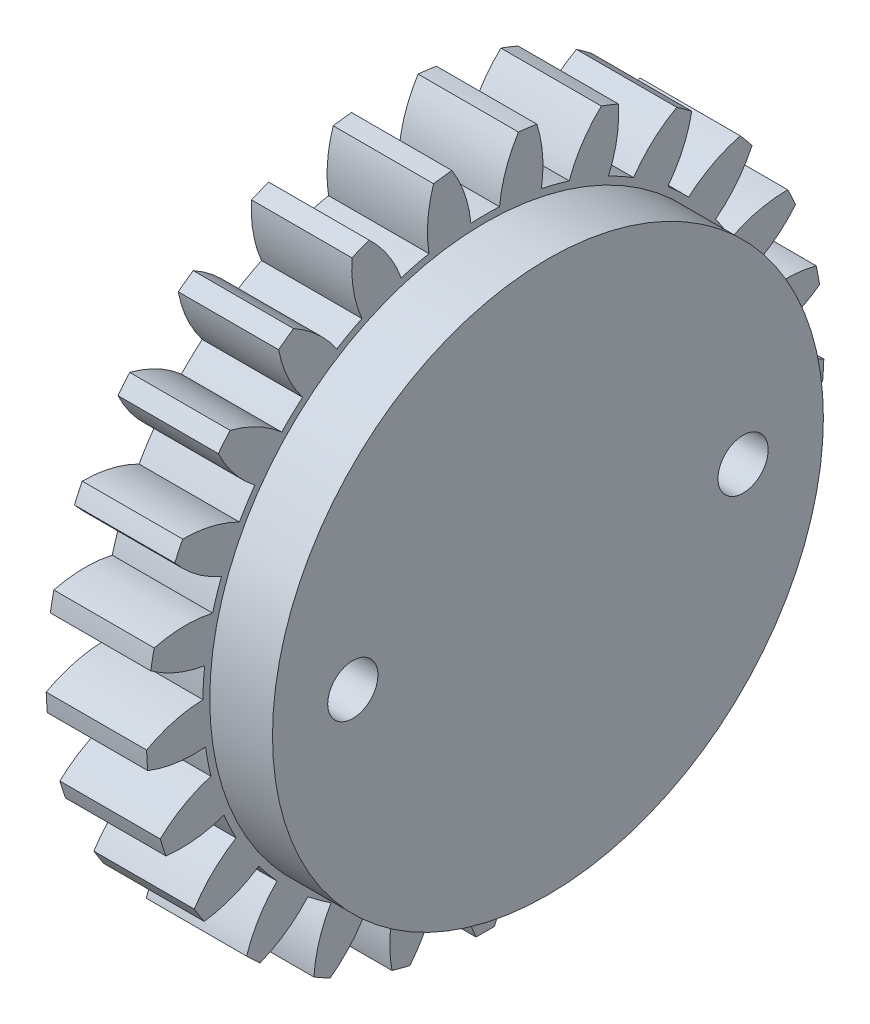
from build123d import *

# Parameters (mm, degrees)
BASPROSKE_W                  = 4
BASPROSKE_H                  = 13.5
TOOTHCUT_DEPTH               = 20.506409203
TEETHCUTS_COUNT              = 25
TEETHCUTS_ANGLE              = 345.6
BORSKE_R                     = 1.5
BORE_DEPTH                   = 50.0000508
ESQUISSE1_R                  = 4.015099064
BOSS_EXTRU_1_DEPTH           = 4
ESQUISSE3_R                  = 10.975
BOSS_EXTRU_2_DEPTH           = 2.5
ENL_V_MAT_EXTRU_1_DEPTH      = 20.500499542
ENL_V_MAT_EXTRU_1_DEPTH_BACK = 20.500499542
ESQUISSE2_R                  = 1
ESQUISSE4_R                  = 2
ENL_V_MAT_EXTRU_2_DEPTH      = 2.5


with BuildPart() as part:
    # BasProSke → Base-Revolve (revolve)
    with BuildSketch(Plane(origin=(0, 0, 0), x_dir=(1, 0, 0), z_dir=(0, 1, 0)), mode=Mode.PRIVATE) as base_revolve_sk:
        with Locations((2, 6.75)):
            Rectangle(BASPROSKE_W, BASPROSKE_H)
    revolve(base_revolve_sk.sketch.rotate(Axis((-10, 0, 0), (1, 0, 0)), 180), axis=Axis((-10, 0, 0), (1, 0, 0)))

    # TooCutSke → ToothCut (cut, through all)
    with BuildSketch(Plane(origin=(0, 0, 0), x_dir=(0, 0, -1), z_dir=(1, 0, 0))):
        with BuildLine():
            ThreePointArc((0.570809389, 11.23450834), (0, 11.249), (-0.570809389, 11.23450834))
            ThreePointArc((-0.570809389, 11.23450834), (-0.823468719, 12.39261054), (-1.341642157, 13.4586939))
            ThreePointArc((-1.341642157, 13.4586939), (0, 13.5254), (1.341642157, 13.4586939))
            ThreePointArc((1.341642157, 13.4586939), (0.823468719, 12.39261054), (0.570809389, 11.23450834))
        make_face()
    toothcut = extrude(amount=TOOTHCUT_DEPTH, mode=Mode.SUBTRACT)

    # TeethCuts: ToothCut ×25 about axis
    teethcuts_axis = Axis((-10, 0, 0), (1, 0, 0))
    for i in range(1, TEETHCUTS_COUNT):
        add(toothcut.rotate(teethcuts_axis, i * TEETHCUTS_ANGLE / (TEETHCUTS_COUNT - 1)), mode=Mode.SUBTRACT)

    # BorSke → Bore (cut, symmetric)
    with BuildSketch(Plane(origin=(0, 0, 0), x_dir=(0, 0, -1), z_dir=(1, 0, 0))):
        with Locations(Location((0, 0, 0), (0, 0, 180))):
            Circle(BORSKE_R)
    extrude(amount=BORE_DEPTH, both=True, mode=Mode.SUBTRACT)

    # Esquisse1 → Boss.-Extru.1 (add)
    with BuildSketch(Plane(origin=(4, 0, 0), x_dir=(0, 0, -1), z_dir=(1, 0, 0))):
        Circle(ESQUISSE1_R)
    extrude(amount=-BOSS_EXTRU_1_DEPTH)

    # Esquisse3 → Boss.-Extru.2 (add)
    with BuildSketch(Plane(origin=(4, 0, 0), x_dir=(0, 0, -1), z_dir=(1, 0, 0))):
        with Locations(Location((0, 0, 0), (0, 0, 180))):
            Circle(ESQUISSE3_R)
    extrude(amount=BOSS_EXTRU_2_DEPTH)

    # Esquisse2 → Enlèv. mat.-Extru.1 (cut, two sides: drawn at the far end of the back side and taken through both)
    with BuildSketch(Plane(origin=(4, 0, 0), x_dir=(0, 0, -1), z_dir=(1, 0, 0)).offset(-ENL_V_MAT_EXTRU_1_DEPTH_BACK)):
        with Locations((-7.775, 0)):
            Circle(ESQUISSE2_R)
        with Locations((7.775, 0)):
            Circle(ESQUISSE2_R)
    extrude(amount=ENL_V_MAT_EXTRU_1_DEPTH + ENL_V_MAT_EXTRU_1_DEPTH_BACK, mode=Mode.SUBTRACT)

    # Esquisse4 → Enlèv. mat.-Extru.2 (cut)
    with BuildSketch(Plane.ZY):
        with Locations((-7.775, 0)):
            Circle(ESQUISSE4_R)
        with Locations((7.775, 0)):
            Circle(ESQUISSE4_R)
    extrude(amount=-ENL_V_MAT_EXTRU_2_DEPTH, mode=Mode.SUBTRACT)


solid = part.part
